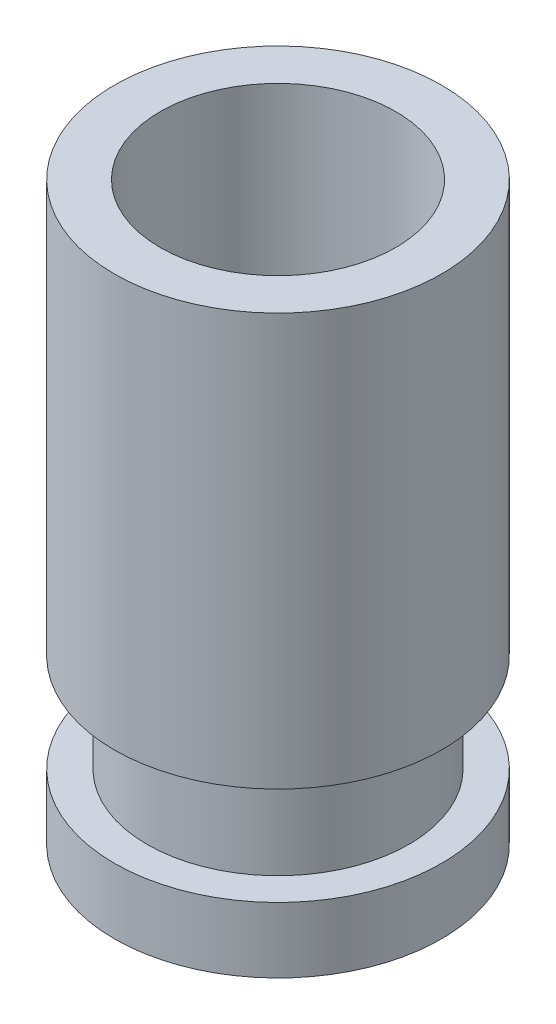
from build123d import *

# Parameters (mm, degrees)
SKETCH1_R           = 25
SKETCH1_R_2         = 18
BOSS_EXTRUDE1_DEPTH = 10
SKETCH2_R           = 20
SKETCH2_R_2         = 18
BOSS_EXTRUDE2_DEPTH = 15
SKETCH3_R           = 25
SKETCH3_R_2         = 18
BOSS_EXTRUDE3_DEPTH = 63


with BuildPart() as part:
    # Sketch1 → Boss-Extrude1 (new body)
    with BuildSketch(Plane(origin=(0, 0, 0), x_dir=(1, 0, 0), z_dir=(0, 1, 0))):
        with Locations(Location((0, 0, 0), (0, 0, 270))):
            Circle(SKETCH1_R)
        with Locations(Location((0, 0, 0), (0, 0, 270))):
            Circle(SKETCH1_R_2, mode=Mode.SUBTRACT)
    extrude(amount=BOSS_EXTRUDE1_DEPTH)

    # Sketch2 → Boss-Extrude2 (add)
    with BuildSketch(Plane(origin=(0, 10, 0), x_dir=(1, 0, 0), z_dir=(0, 1, 0))):
        with Locations(Location((0, 0, 0), (0, 0, 270))):
            Circle(SKETCH2_R)
        with Locations(Location((0, 0, 0), (0, 0, 270))):
            Circle(SKETCH2_R_2, mode=Mode.SUBTRACT)
    extrude(amount=BOSS_EXTRUDE2_DEPTH)

    # Sketch3 → Boss-Extrude3 (add)
    with BuildSketch(Plane(origin=(0, 25, 0), x_dir=(1, 0, 0), z_dir=(0, 1, 0))):
        with Locations(Location((0, 0, 0), (0, 0, 270))):
            Circle(SKETCH3_R)
        with Locations(Location((0, 0, 0), (0, 0, 270))):
            Circle(SKETCH3_R_2, mode=Mode.SUBTRACT)
    extrude(amount=BOSS_EXTRUDE3_DEPTH)


solid = part.part
